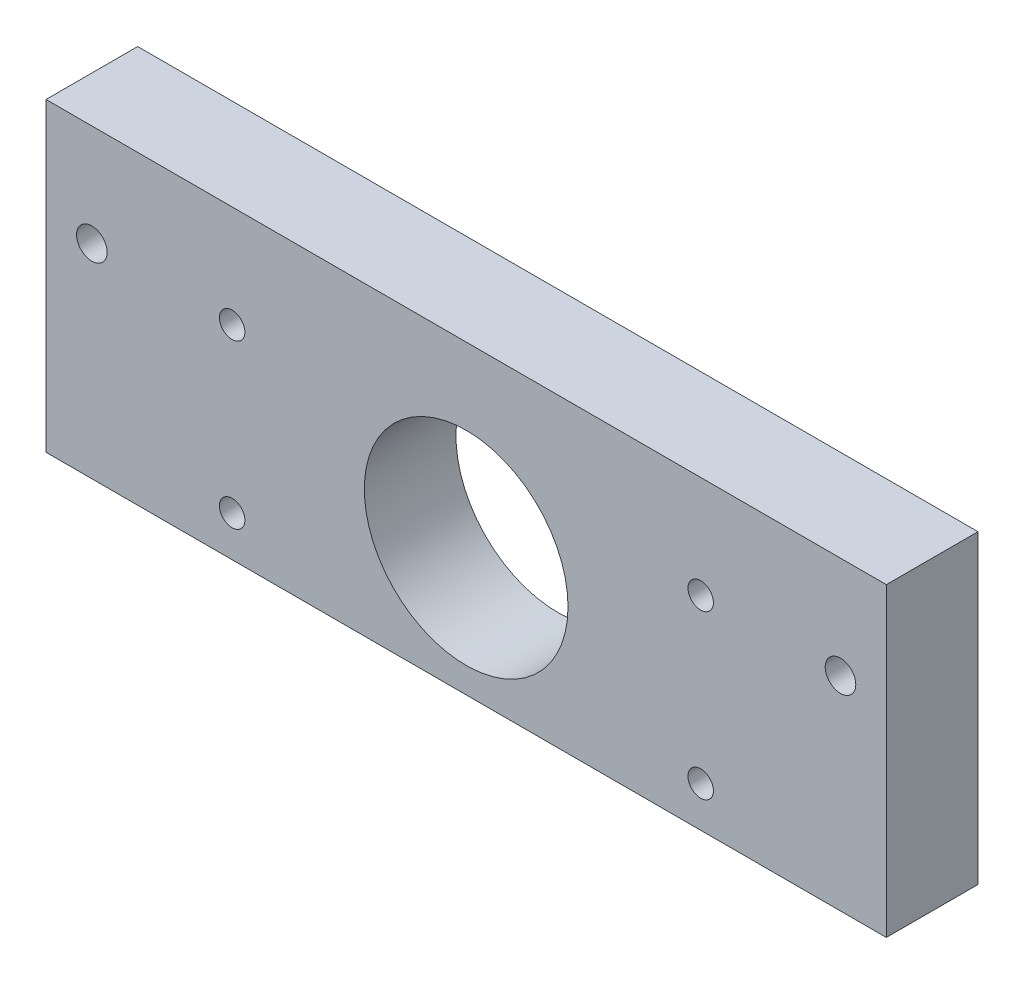
from build123d import *

# Parameters (mm, degrees)
SKETCH1_W                    = 165
SKETCH1_H                    = 60
BOSS_EXTRUDE1_DEPTH          = 18
SKETCH3_R                    = 20
CUT_EXTRUDE2_DEPTH           = 18
F_4_0_4_DIAMETER_HOLE1_D     = 4
F_4_0_4_DIAMETER_HOLE1_DEPTH = 30
F_4_0_4_DIAMETER_HOLE1_TIP   = 1.201721238
F_6_0_6_DIAMETER_HOLE2_D     = 6
F_6_0_6_DIAMETER_HOLE2_DEPTH = 14
F_5_0_5_DIAMETER_HOLE1_D     = 5


with BuildPart() as part:
    # Sketch1 → Boss-Extrude1 (new body)
    with BuildSketch(Plane.XY):
        Rectangle(SKETCH1_W, SKETCH1_H)
    extrude(amount=BOSS_EXTRUDE1_DEPTH)

    # Sketch3 → Cut-Extrude2 (cut)
    with BuildSketch(Plane.XY.offset(18)):
        with Locations((0, -5)):
            Circle(SKETCH3_R)
    extrude(amount=-CUT_EXTRUDE2_DEPTH, mode=Mode.SUBTRACT)

    # Ø4.0 (4) Diameter Hole1
    with Locations(Plane(origin=(0, -30, 0), x_dir=(-1, 0, 0), z_dir=(0, -1, 0))):
        with Locations((57.5, -9), (-57.5, -9)):
            Hole(F_4_0_4_DIAMETER_HOLE1_D / 2, depth=F_4_0_4_DIAMETER_HOLE1_DEPTH)
            with Locations((0, 0, -(F_4_0_4_DIAMETER_HOLE1_DEPTH + F_4_0_4_DIAMETER_HOLE1_TIP / 2))):  # 118° drill point
                Cone(0, F_4_0_4_DIAMETER_HOLE1_D / 2, F_4_0_4_DIAMETER_HOLE1_TIP, mode=Mode.SUBTRACT)

    # Ø6.0 (6) Diameter Hole2
    with Locations(Plane.XY.offset(18)):
        with Locations((73.5, 10), (-73.5, 10)):
            Hole(F_6_0_6_DIAMETER_HOLE2_D / 2, depth=F_6_0_6_DIAMETER_HOLE2_DEPTH)

    # Ø5.0 (5) Diameter Hole1 (through all)
    with Locations(Plane(origin=(0, 0, 0), x_dir=(-1, 0, 0), z_dir=(0, 0, -1))):
        with Locations((-46.05, 9.95), (-46.05, -22.05), (45.95, 9.95), (45.95, -22.05)):
            Hole(F_5_0_5_DIAMETER_HOLE1_D / 2)


solid = part.part
